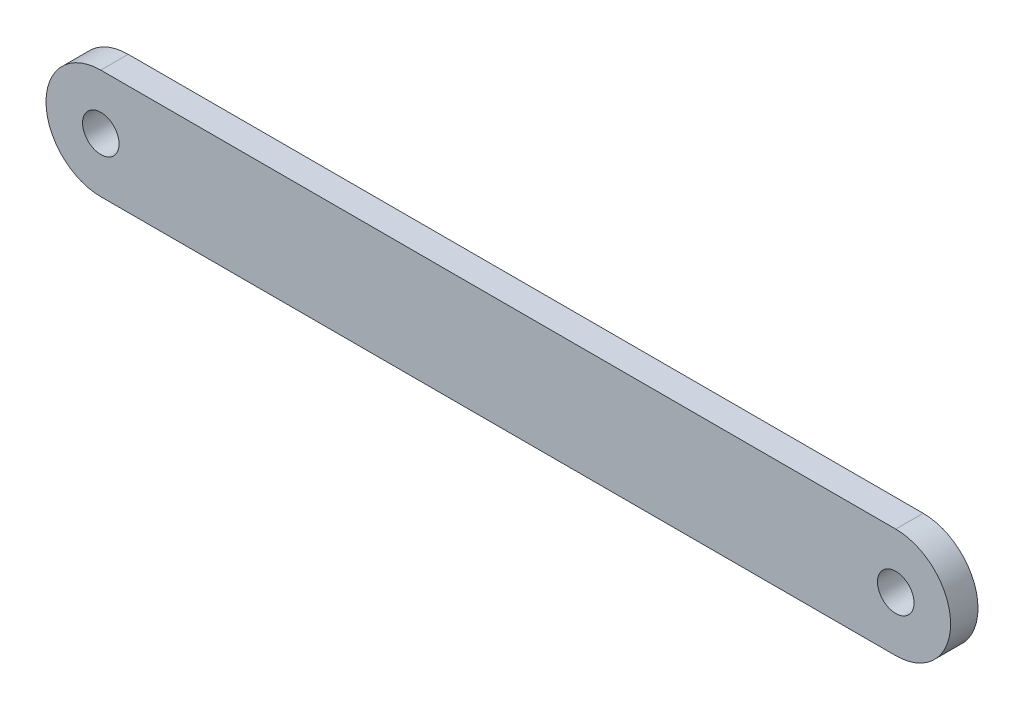
from build123d import *

# Parameters (mm, degrees)
SKETCH1_R           = 2
BOSS_EXTRUDE3_DEPTH = 3


with BuildPart() as part:
    # Sketch1 → Boss-Extrude3 (new body)
    with BuildSketch(Plane.XY):
        with BuildLine():
            Line((-35.312724167, 6), (51.687275833, 6))
            ThreePointArc((51.687275833, 6), (57.687275833, 0), (51.687275833, -6))
            Line((51.687275833, -6), (-35.312724167, -6))
            ThreePointArc((-35.312724167, -6), (-41.312724167, 0), (-35.312724167, 6))
        make_face()
        with Locations((-35.312724167, 0)):
            Circle(SKETCH1_R, mode=Mode.SUBTRACT)
        with Locations((51.687275833, 0)):
            Circle(SKETCH1_R, mode=Mode.SUBTRACT)
    extrude(amount=BOSS_EXTRUDE3_DEPTH)


solid = part.part
